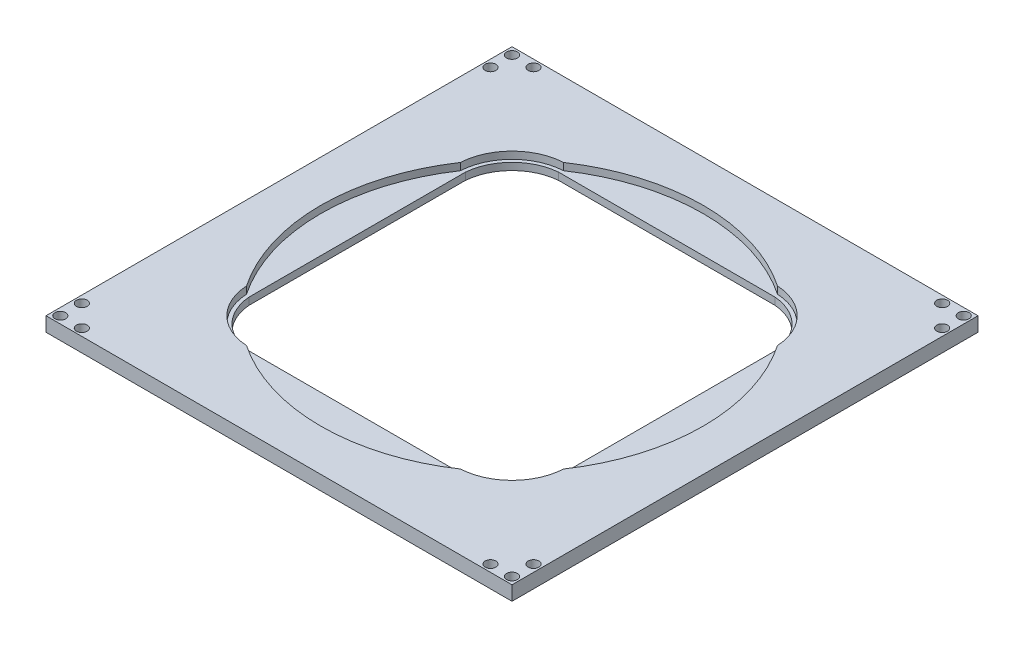
from build123d import *

# Parameters (mm, degrees)
SKETCH1_W           = 130
SKETCH1_H           = 130
BOSS_EXTRUDE1_DEPTH = 4
CUT_EXTRUDE1_DEPTH  = 4
SKETCH6_W           = 60.337998114
SKETCH6_H           = 11.352835906
BOSS_EXTRUDE2_DEPTH = 2
CIRPATTERN1_COUNT   = 4
BOSS_EXTRUDE3_START = -2
BOSS_EXTRUDE3_DEPTH = 2
CIRPATTERN2_COUNT   = 4
SKETCH10_R          = 1.5
CUT_EXTRUDE2_DEPTH  = 93.010868923
CIRPATTERN3_COUNT   = 4


with BuildPart() as part:
    # Sketch1 → Boss-Extrude1 (new body)
    with BuildSketch(Plane(origin=(0, 0, 0), x_dir=(1, 0, 0), z_dir=(0, 1, 0))):
        Rectangle(SKETCH1_W, SKETCH1_H)
    extrude(amount=BOSS_EXTRUDE1_DEPTH)

    # Sketch5 → Cut-Extrude1 (cut)
    with BuildSketch(Plane(origin=(0, 4, 0), x_dir=(1, 0, 0), z_dir=(0, 1, 0))):
        with BuildLine():
            ThreePointArc((29.836037364, 44.227066084), (0, 53.35), (-29.836037364, 44.227066084))
            ThreePointArc((-29.836037364, 44.227066084), (-39.783378413, 39.783378413), (-44.227066084, 29.836037364))
            ThreePointArc((-44.227066084, 29.836037364), (-53.35, 0), (-44.227066084, -29.836037364))
            ThreePointArc((-44.227066084, -29.836037364), (-39.783378413, -39.783378413), (-29.836037364, -44.227066084))
            ThreePointArc((-29.836037364, -44.227066084), (0, -53.35), (29.836037364, -44.227066084))
            ThreePointArc((29.836037364, -44.227066084), (39.783378413, -39.783378413), (44.227066084, -29.836037364))
            ThreePointArc((44.227066084, -29.836037364), (53.35, 0), (44.227066084, 29.836037364))
            ThreePointArc((44.227066084, 29.836037364), (39.783378413, 39.783378413), (29.836037364, 44.227066084))
        make_face()
    extrude(amount=-CUT_EXTRUDE1_DEPTH, mode=Mode.SUBTRACT)

    # Sketch6 → Boss-Extrude2 (add)
    with BuildSketch(Plane.XZ):
        with Locations((0, 48.86626436)):
            Rectangle(SKETCH6_W, SKETCH6_H)
    boss_extrude2 = extrude(amount=-BOSS_EXTRUDE2_DEPTH)

    # CirPattern1: Boss-Extrude2 ×4 about axis
    cirpattern1_axis = Axis((0, 0, 0), (0, 1, 0))
    for i in range(1, CIRPATTERN1_COUNT):
        add(boss_extrude2.rotate(cirpattern1_axis, i * 360 / CIRPATTERN1_COUNT))

    # Sketch9 → Boss-Extrude3 (add)
    with BuildSketch(Plane.XZ.offset(BOSS_EXTRUDE3_START)):
        with BuildLine():
            Line((-30.168999057, 44.20512878), (-30.168999057, 43.189846407))
            ThreePointArc((-30.168999057, 43.189846407), (-39.067728141, 39.067728141), (-43.189846407, 30.168999057))
            Line((-43.189846407, 30.168999057), (-44.20512878, 30.168999057))
            ThreePointArc((-44.20512878, 30.168999057), (-39.783378413, 39.783378413), (-30.168999057, 44.20512878))
        make_face()
    boss_extrude3 = extrude(amount=BOSS_EXTRUDE3_DEPTH)

    # CirPattern2: Boss-Extrude3 ×4 about axis
    cirpattern2_axis = Axis((0, 0, 0), (0, 1, 0))
    for i in range(1, CIRPATTERN2_COUNT):
        add(boss_extrude3.rotate(cirpattern2_axis, i * 360 / CIRPATTERN2_COUNT))

    # Sketch10 → Cut-Extrude2 (cut, through all)
    with BuildSketch(Plane(origin=(0, 4, 0), x_dir=(1, 0, 0), z_dir=(0, 1, 0))):
        with Locations(Location((-63, 63, 0), (0, 0, 270))):
            Circle(SKETCH10_R)
        with Locations(Location((-57, 63, 0), (0, 0, 270))):
            Circle(SKETCH10_R)
        with Locations(Location((-63, 57, 0), (0, 0, 270))):
            Circle(SKETCH10_R)
    cut_extrude2 = extrude(amount=-CUT_EXTRUDE2_DEPTH, mode=Mode.SUBTRACT)

    # CirPattern3: Cut-Extrude2 ×4 about axis
    cirpattern3_axis = Axis((0, 0, 0), (0, 1, 0))
    for i in range(1, CIRPATTERN3_COUNT):
        add(cut_extrude2.rotate(cirpattern3_axis, i * 360 / CIRPATTERN3_COUNT), mode=Mode.SUBTRACT)


solid = part.part
